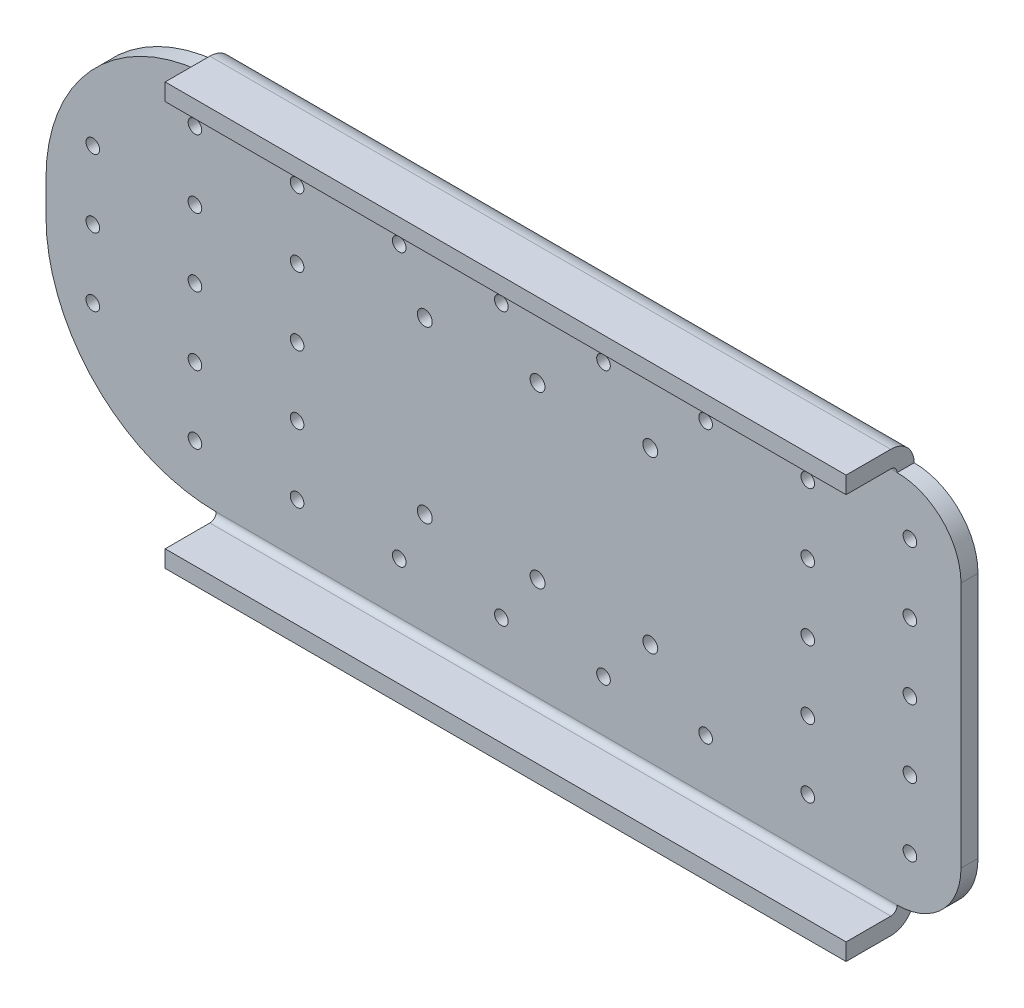
from build123d import *

# Parameters (mm, degrees)
SKETCH1_W           = 215
SKETCH1_H           = 88
SKETCH1_R           = 1.75
BOSS_EXTRUDE1_DEPTH = 4
FILLET1_R           = 15
FILLET2_R           = 40
BOSS_EXTRUDE2_DEPTH = 160
SKETCH3_R           = 1.6
CUT_EXTRUDE1_DEPTH  = 4


with BuildPart() as part:
    # Sketch1 → Boss-Extrude1 (new body)
    with BuildSketch(Plane.XY):
        with Locations((-8, 0)):
            Rectangle(SKETCH1_W, SKETCH1_H)
        with Locations((-26.5, 20)):
            Circle(SKETCH1_R, mode=Mode.SUBTRACT)
        with Locations((26.5, 20)):
            Circle(SKETCH1_R, mode=Mode.SUBTRACT)
        with Locations((-26.5, -20)):
            Circle(SKETCH1_R, mode=Mode.SUBTRACT)
        with Locations((26.5, -20)):
            Circle(SKETCH1_R, mode=Mode.SUBTRACT)
        with Locations((0, 20)):
            Circle(SKETCH1_R, mode=Mode.SUBTRACT)
        with Locations((0, -20)):
            Circle(SKETCH1_R, mode=Mode.SUBTRACT)
    extrude(amount=BOSS_EXTRUDE1_DEPTH)

    # Fillet1
    fillet1_edges = [part.edges().sort_by_distance(p)[0] for p in [
        (99.5, -44, 2),
        (99.5, 44, 2),
    ]]
    fillet(fillet1_edges, radius=FILLET1_R)

    # Fillet2
    fillet2_edges = [part.edges().sort_by_distance(p)[0] for p in [
        (-115.5, -44, 2),
        (-115.5, 44, 2),
    ]]
    fillet(fillet2_edges, radius=FILLET2_R)

    # Sketch2 → Boss-Extrude2 (add)
    with BuildSketch(Plane.ZY.offset(75.5)):
        with BuildLine():
            Line((0, -44), (4, -44))
            ThreePointArc((4, -44), (4.439339828, -45.060660172), (5.5, -45.5))
            Line((5.5, -45.5), (16, -45.5))
            Line((16, -45.5), (16, -49.5))
            Line((16, -49.5), (5.5, -49.5))
            ThreePointArc((5.5, -49.5), (1.610912703, -47.889087297), (0, -44))
        make_face()
        with BuildLine():
            Line((16, 49.5), (5.5, 49.5))
            ThreePointArc((5.5, 49.5), (1.610912703, 47.889087297), (0, 44))
            Line((0, 44), (4, 44))
            ThreePointArc((4, 44), (4.439339828, 45.060660172), (5.5, 45.5))
            Line((5.5, 45.5), (16, 45.5))
            Line((16, 45.5), (16, 49.5))
        make_face()
    extrude(amount=-BOSS_EXTRUDE2_DEPTH)

    # Sketch3 → Cut-Extrude1 (cut)
    with BuildSketch(Plane.XY.offset(4)):
        with Locations((63.5, -32)):
            Circle(SKETCH3_R)
        with Locations((39.5, -32)):
            Circle(SKETCH3_R)
        with Locations((15.5, -32)):
            Circle(SKETCH3_R)
        with Locations((87.5, -32)):
            Circle(SKETCH3_R)
        with Locations((87.5, -16)):
            Circle(SKETCH3_R)
        with Locations((-8.5, -32)):
            Circle(SKETCH3_R)
        with Locations((-32.5, -32)):
            Circle(SKETCH3_R)
        with Locations((-56.5, -32)):
            Circle(SKETCH3_R)
        with Locations((-80.5, -32)):
            Circle(SKETCH3_R)
        with Locations((87.5, 0)):
            Circle(SKETCH3_R)
        with Locations((63.5, -16)):
            Circle(SKETCH3_R)
        with Locations((63.5, 0)):
            Circle(SKETCH3_R)
        with Locations((-56.5, -16)):
            Circle(SKETCH3_R)
        with Locations((-80.5, -16)):
            Circle(SKETCH3_R)
        with Locations((-104.5, -16)):
            Circle(SKETCH3_R)
        with Locations((-56.5, 0)):
            Circle(SKETCH3_R)
        with Locations((-80.5, 0)):
            Circle(SKETCH3_R)
        with Locations((-104.5, 0)):
            Circle(SKETCH3_R)
    cut_extrude1 = extrude(amount=-CUT_EXTRUDE1_DEPTH, mode=Mode.SUBTRACT)

    # Mirror5: Cut-Extrude1 across plane
    add(cut_extrude1.mirror(Plane.ZX), mode=Mode.SUBTRACT)


solid = part.part
